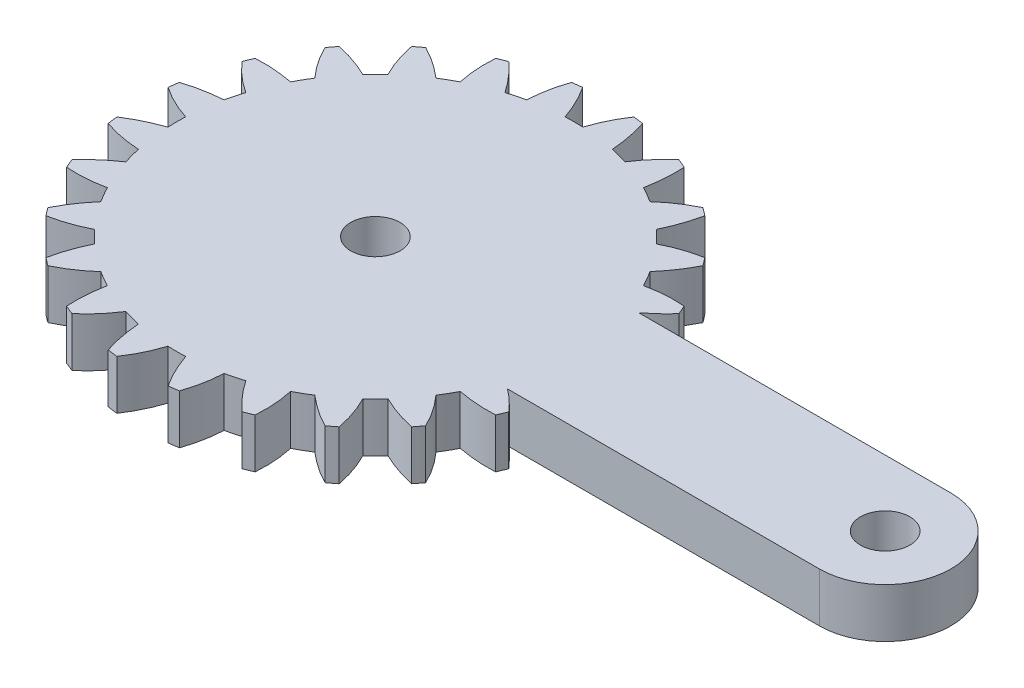
from build123d import *

# Parameters (mm, degrees)
SKETCH2_R           = 1.5
BOSS_EXTRUDE1_DEPTH = 3


with BuildPart() as part:
    # Sketch2 → Boss-Extrude1 (new body)
    with BuildSketch(Plane(origin=(0, 0, 0), x_dir=(1, 0, 0), z_dir=(0, 1, 0))):
        with BuildLine():
            Line((31, 4.000000001), (12.012859152, 4.000000001))
            add(Edge.make_bspline(
                [(13.278985865, 5.170206419), (12.8954662, 4.733530556), (12.462190225, 4.344528056), (12.012859152, 4.000000001)],
                knots=[0.154712813, 0.154712813, 0.154712813, 0.154712813, 0.777489596, 0.777489596, 0.777489596, 0.777489596], degree=3))
            ThreePointArc((13.278985865, 5.170206419), (13.165283338, 5.453238911), (13.045548971, 5.733772933))
            add(Edge.make_bspline(
                [(10.729735914, 5.571433139), (11.468148216, 5.731782959), (12.25282672, 5.797378255), (13.045548971, 5.733772933)],
                knots=[0, 0, 0, 0, 0.84522739, 0.84522739, 0.84522739, 0.84522739], degree=3))
            ThreePointArc((10.729735914, 5.571433139), (10.602635836, 5.809665509), (10.470247132, 6.045))
            ThreePointArc((10.470247132, 6.045), (10.332600838, 6.277376835), (10.189798038, 6.506620931))
            add(Edge.make_bspline(
                [(11.488367505, 8.430890348), (11.138958904, 7.723663869), (10.678280228, 7.077546079), (10.189798038, 6.506620931)],
                knots=[0.154712813, 0.154712813, 0.154712813, 0.154712813, 1, 1, 1, 1], degree=3))
            ThreePointArc((11.488367505, 8.430890348), (11.305285099, 8.674850363), (11.117023034, 8.914835886))
            add(Edge.make_bspline(
                [(8.922136024, 8.158651162), (9.593885949, 8.504652361), (10.334849869, 8.771102293), (11.117023034, 8.914835886)],
                knots=[0, 0, 0, 0, 0.84522739, 0.84522739, 0.84522739, 0.84522739], degree=3))
            ThreePointArc((8.922136024, 8.158651162), (8.737707702, 8.35587004), (8.548920985, 8.548920985))
            ThreePointArc((8.548920985, 8.548920985), (8.355821324, 8.737754288), (8.158551674, 8.922226997))
            add(Edge.make_bspline(
                [(8.914835886, 11.117023034), (8.760376776, 10.343461111), (8.482622935, 9.600126837), (8.158551674, 8.922226997)],
                knots=[0.154712813, 0.154712813, 0.154712813, 0.154712813, 1, 1, 1, 1], degree=3))
            ThreePointArc((8.914835886, 11.117023034), (8.674850363, 11.305285099), (8.430890348, 11.488367505))
            add(Edge.make_bspline(
                [(6.506507308, 10.189870591), (7.065816209, 10.697943759), (7.71257008, 11.147090204), (8.430890348, 11.488367505)],
                knots=[0, 0, 0, 0, 0.84522739, 0.84522739, 0.84522739, 0.84522739], degree=3))
            ThreePointArc((6.506507308, 10.189870591), (6.277319227, 10.332635836), (6.045, 10.470247132))
            ThreePointArc((6.045, 10.470247132), (5.809606396, 10.602668227), (5.571313495, 10.729798038))
            add(Edge.make_bspline(
                [(5.733772933, 13.045548971), (5.784789448, 12.258368573), (5.708888907, 11.468474815), (5.571313495, 10.729798038)],
                knots=[0.154712813, 0.154712813, 0.154712813, 0.154712813, 1, 1, 1, 1], degree=3))
            ThreePointArc((5.733772933, 13.045548971), (5.453238911, 13.165283338), (5.170206419, 13.278985865))
            add(Edge.make_bspline(
                [(3.647470872, 11.526667178), (4.056222772, 12.16218797), (4.564691385, 12.76342234), (5.170206419, 13.278985865)],
                knots=[0, 0, 0, 0, 0.84522739, 0.84522739, 0.84522739, 0.84522739], degree=3))
            ThreePointArc((3.647470872, 11.526667178), (3.389141821, 11.605249576), (3.129122255, 11.67804324))
            ThreePointArc((3.129122255, 11.67804324), (2.867476392, 11.745027848), (2.604399509, 11.806151075))
            add(Edge.make_bspline(
                [(2.161962831, 14.085042304), (2.414978279, 13.337888473), (2.546103534, 12.555265188), (2.604399509, 11.806151075)],
                knots=[0.154712813, 0.154712813, 0.154712813, 0.154712813, 1, 1, 1, 1], degree=3))
            ThreePointArc((2.161962831, 14.085042304), (1.859998239, 14.128089275), (1.557181466, 14.164663282))
            add(Edge.make_bspline(
                [(0.539865323, 12.077940447), (0.770204456, 12.797599169), (1.105736515, 13.509948335), (1.557181466, 14.164663282)],
                knots=[0, 0, 0, 0, 0.84522739, 0.84522739, 0.84522739, 0.84522739], degree=3))
            ThreePointArc((0.539865323, 12.077940447), (0.27, 12.086984736), (0, 12.09))
            ThreePointArc((0, 12.09), (-0.270067389, 12.08698323), (-0.54, 12.077934426))
            add(Edge.make_bspline(
                [(-1.557181466, 14.164663282), (-1.119409669, 13.508453317), (-0.790194587, 12.786434986), (-0.54, 12.077934426)],
                knots=[0.154712813, 0.154712813, 0.154712813, 0.154712813, 1, 1, 1, 1], degree=3))
            ThreePointArc((-1.557181466, 14.164663282), (-1.859998239, 14.128089275), (-2.161962831, 14.085042304))
            add(Edge.make_bspline(
                [(-2.604531155, 11.806122033), (-2.568302021, 12.560875133), (-2.42857247, 13.335793678), (-2.161962831, 14.085042304)],
                knots=[0, 0, 0, 0, 0.84522739, 0.84522739, 0.84522739, 0.84522739], degree=3))
            ThreePointArc((-2.604531155, 11.806122033), (-2.867541874, 11.74501186), (-3.129122255, 11.67804324))
            ThreePointArc((-3.129122255, 11.67804324), (-3.389206524, 11.60523068), (-3.647599401, 11.526626506))
            add(Edge.make_bspline(
                [(-5.170206419, 13.278985865), (-4.577511698, 12.75843939), (-4.072642252, 12.146230371), (-3.647599401, 11.526626506)],
                knots=[0.154712813, 0.154712813, 0.154712813, 0.154712813, 1, 1, 1, 1], degree=3))
            ThreePointArc((-5.170206419, 13.278985865), (-5.453238911, 13.165283338), (-5.733772933, 13.045548971))
            add(Edge.make_bspline(
                [(-5.571433139, 10.729735914), (-5.731782959, 11.468148216), (-5.797378255, 12.25282672), (-5.733772933, 13.045548971)],
                knots=[0, 0, 0, 0, 0.84522739, 0.84522739, 0.84522739, 0.84522739], degree=3))
            ThreePointArc((-5.571433139, 10.729735914), (-5.809665509, 10.602635836), (-6.045, 10.470247132))
            ThreePointArc((-6.045, 10.470247132), (-6.277376835, 10.332600838), (-6.506620931, 10.189798038))
            add(Edge.make_bspline(
                [(-8.430890348, 11.488367505), (-7.723663869, 11.138958904), (-7.077546079, 10.678280228), (-6.506620931, 10.189798038)],
                knots=[0.154712813, 0.154712813, 0.154712813, 0.154712813, 1, 1, 1, 1], degree=3))
            ThreePointArc((-8.430890348, 11.488367505), (-8.674850363, 11.305285099), (-8.914835886, 11.117023034))
            add(Edge.make_bspline(
                [(-8.158651162, 8.922136024), (-8.504652361, 9.593885949), (-8.771102293, 10.334849869), (-8.914835886, 11.117023034)],
                knots=[0, 0, 0, 0, 0.84522739, 0.84522739, 0.84522739, 0.84522739], degree=3))
            ThreePointArc((-8.158651162, 8.922136024), (-8.35587004, 8.737707702), (-8.548920985, 8.548920985))
            ThreePointArc((-8.548920985, 8.548920985), (-8.737754288, 8.355821324), (-8.922226997, 8.158551674))
            add(Edge.make_bspline(
                [(-11.117023034, 8.914835886), (-10.343461111, 8.760376776), (-9.600126837, 8.482622935), (-8.922226997, 8.158551674)],
                knots=[0.154712813, 0.154712813, 0.154712813, 0.154712813, 1, 1, 1, 1], degree=3))
            ThreePointArc((-11.117023034, 8.914835886), (-11.305285099, 8.674850363), (-11.488367505, 8.430890348))
            add(Edge.make_bspline(
                [(-10.189870591, 6.506507308), (-10.697943759, 7.065816209), (-11.147090204, 7.71257008), (-11.488367505, 8.430890348)],
                knots=[0, 0, 0, 0, 0.84522739, 0.84522739, 0.84522739, 0.84522739], degree=3))
            ThreePointArc((-10.189870591, 6.506507308), (-10.332635836, 6.277319227), (-10.470247132, 6.045))
            ThreePointArc((-10.470247132, 6.045), (-10.602668227, 5.809606396), (-10.729798038, 5.571313495))
            add(Edge.make_bspline(
                [(-13.045548971, 5.733772933), (-12.258368573, 5.784789448), (-11.468474815, 5.708888907), (-10.729798038, 5.571313495)],
                knots=[0.154712813, 0.154712813, 0.154712813, 0.154712813, 1, 1, 1, 1], degree=3))
            ThreePointArc((-13.045548971, 5.733772933), (-13.165283338, 5.453238911), (-13.278985865, 5.170206419))
            add(Edge.make_bspline(
                [(-11.526667178, 3.647470872), (-12.16218797, 4.056222772), (-12.76342234, 4.564691385), (-13.278985865, 5.170206419)],
                knots=[0, 0, 0, 0, 0.84522739, 0.84522739, 0.84522739, 0.84522739], degree=3))
            ThreePointArc((-11.526667178, 3.647470872), (-11.605249576, 3.389141821), (-11.67804324, 3.129122255))
            ThreePointArc((-11.67804324, 3.129122255), (-11.745027848, 2.867476392), (-11.806151075, 2.604399509))
            add(Edge.make_bspline(
                [(-14.085042304, 2.161962831), (-13.337888473, 2.414978279), (-12.555265188, 2.546103534), (-11.806151075, 2.604399509)],
                knots=[0.154712813, 0.154712813, 0.154712813, 0.154712813, 1, 1, 1, 1], degree=3))
            ThreePointArc((-14.085042304, 2.161962831), (-14.128089275, 1.859998239), (-14.164663282, 1.557181466))
            add(Edge.make_bspline(
                [(-12.077940447, 0.539865323), (-12.797599169, 0.770204456), (-13.509948335, 1.105736515), (-14.164663282, 1.557181466)],
                knots=[0, 0, 0, 0, 0.84522739, 0.84522739, 0.84522739, 0.84522739], degree=3))
            ThreePointArc((-12.077940447, 0.539865323), (-12.086984736, 0.27), (-12.09, 0))
            ThreePointArc((-12.09, 0), (-12.08698323, -0.270067389), (-12.077934426, -0.54))
            add(Edge.make_bspline(
                [(-14.164663282, -1.557181466), (-13.508453317, -1.119409669), (-12.786434986, -0.790194587), (-12.077934426, -0.54)],
                knots=[0.154712813, 0.154712813, 0.154712813, 0.154712813, 1, 1, 1, 1], degree=3))
            ThreePointArc((-14.164663282, -1.557181466), (-14.128089275, -1.859998239), (-14.085042304, -2.161962831))
            add(Edge.make_bspline(
                [(-11.806122033, -2.604531155), (-12.560875133, -2.568302021), (-13.335793678, -2.42857247), (-14.085042304, -2.161962831)],
                knots=[0, 0, 0, 0, 0.84522739, 0.84522739, 0.84522739, 0.84522739], degree=3))
            ThreePointArc((-11.806122033, -2.604531155), (-11.74501186, -2.867541874), (-11.67804324, -3.129122255))
            ThreePointArc((-11.67804324, -3.129122255), (-11.60523068, -3.389206524), (-11.526626506, -3.647599401))
            add(Edge.make_bspline(
                [(-13.278985865, -5.170206419), (-12.75843939, -4.577511698), (-12.146230371, -4.072642252), (-11.526626506, -3.647599401)],
                knots=[0.154712813, 0.154712813, 0.154712813, 0.154712813, 1, 1, 1, 1], degree=3))
            ThreePointArc((-13.278985865, -5.170206419), (-13.165283338, -5.453238911), (-13.045548971, -5.733772933))
            add(Edge.make_bspline(
                [(-10.729735914, -5.571433139), (-11.468148216, -5.731782959), (-12.25282672, -5.797378255), (-13.045548971, -5.733772933)],
                knots=[0, 0, 0, 0, 0.84522739, 0.84522739, 0.84522739, 0.84522739], degree=3))
            ThreePointArc((-10.729735914, -5.571433139), (-10.602635836, -5.809665509), (-10.470247132, -6.045))
            ThreePointArc((-10.470247132, -6.045), (-10.332600838, -6.277376835), (-10.189798038, -6.506620931))
            add(Edge.make_bspline(
                [(-11.488367505, -8.430890348), (-11.138958904, -7.723663869), (-10.678280228, -7.077546079), (-10.189798038, -6.506620931)],
                knots=[0.154712813, 0.154712813, 0.154712813, 0.154712813, 1, 1, 1, 1], degree=3))
            ThreePointArc((-11.488367505, -8.430890348), (-11.305285099, -8.674850363), (-11.117023034, -8.914835886))
            add(Edge.make_bspline(
                [(-8.922136024, -8.158651162), (-9.593885949, -8.504652361), (-10.334849869, -8.771102293), (-11.117023034, -8.914835886)],
                knots=[0, 0, 0, 0, 0.84522739, 0.84522739, 0.84522739, 0.84522739], degree=3))
            ThreePointArc((-8.922136024, -8.158651162), (-8.737707702, -8.35587004), (-8.548920985, -8.548920985))
            ThreePointArc((-8.548920985, -8.548920985), (-8.355821324, -8.737754288), (-8.158551674, -8.922226997))
            add(Edge.make_bspline(
                [(-8.914835886, -11.117023034), (-8.760376776, -10.343461111), (-8.482622935, -9.600126837), (-8.158551674, -8.922226997)],
                knots=[0.154712813, 0.154712813, 0.154712813, 0.154712813, 1, 1, 1, 1], degree=3))
            ThreePointArc((-8.914835886, -11.117023034), (-8.674850363, -11.305285099), (-8.430890348, -11.488367505))
            add(Edge.make_bspline(
                [(-6.506507308, -10.189870591), (-7.065816209, -10.697943759), (-7.71257008, -11.147090204), (-8.430890348, -11.488367505)],
                knots=[0, 0, 0, 0, 0.84522739, 0.84522739, 0.84522739, 0.84522739], degree=3))
            ThreePointArc((-6.506507308, -10.189870591), (-6.277319227, -10.332635836), (-6.045, -10.470247132))
            ThreePointArc((-6.045, -10.470247132), (-5.809606396, -10.602668227), (-5.571313495, -10.729798038))
            add(Edge.make_bspline(
                [(-5.733772933, -13.045548971), (-5.784789448, -12.258368573), (-5.708888907, -11.468474815), (-5.571313495, -10.729798038)],
                knots=[0.154712813, 0.154712813, 0.154712813, 0.154712813, 1, 1, 1, 1], degree=3))
            ThreePointArc((-5.733772933, -13.045548971), (-5.453238911, -13.165283338), (-5.170206419, -13.278985865))
            add(Edge.make_bspline(
                [(-3.647470872, -11.526667178), (-4.056222772, -12.16218797), (-4.564691385, -12.76342234), (-5.170206419, -13.278985865)],
                knots=[0, 0, 0, 0, 0.84522739, 0.84522739, 0.84522739, 0.84522739], degree=3))
            ThreePointArc((-3.647470872, -11.526667178), (-3.389141821, -11.605249576), (-3.129122255, -11.67804324))
            ThreePointArc((-3.129122255, -11.67804324), (-2.867476392, -11.745027848), (-2.604399509, -11.806151075))
            add(Edge.make_bspline(
                [(-2.161962831, -14.085042304), (-2.414978279, -13.337888473), (-2.546103534, -12.555265188), (-2.604399509, -11.806151075)],
                knots=[0.154712813, 0.154712813, 0.154712813, 0.154712813, 1, 1, 1, 1], degree=3))
            ThreePointArc((-2.161962831, -14.085042304), (-1.859998239, -14.128089275), (-1.557181466, -14.164663282))
            add(Edge.make_bspline(
                [(-0.539865323, -12.077940447), (-0.770204456, -12.797599169), (-1.105736515, -13.509948335), (-1.557181466, -14.164663282)],
                knots=[0, 0, 0, 0, 0.84522739, 0.84522739, 0.84522739, 0.84522739], degree=3))
            ThreePointArc((-0.539865323, -12.077940447), (-0.27, -12.086984736), (0, -12.09))
            ThreePointArc((0, -12.09), (0.270067389, -12.08698323), (0.54, -12.077934426))
            add(Edge.make_bspline(
                [(1.557181466, -14.164663282), (1.119409669, -13.508453317), (0.790194587, -12.786434986), (0.54, -12.077934426)],
                knots=[0.154712813, 0.154712813, 0.154712813, 0.154712813, 1, 1, 1, 1], degree=3))
            ThreePointArc((1.557181466, -14.164663282), (1.859998239, -14.128089275), (2.161962831, -14.085042304))
            add(Edge.make_bspline(
                [(2.604531155, -11.806122033), (2.568302021, -12.560875133), (2.42857247, -13.335793678), (2.161962831, -14.085042304)],
                knots=[0, 0, 0, 0, 0.84522739, 0.84522739, 0.84522739, 0.84522739], degree=3))
            ThreePointArc((2.604531155, -11.806122033), (2.867541874, -11.74501186), (3.129122255, -11.67804324))
            ThreePointArc((3.129122255, -11.67804324), (3.389206524, -11.60523068), (3.647599401, -11.526626506))
            add(Edge.make_bspline(
                [(5.170206419, -13.278985865), (4.577511698, -12.75843939), (4.072642252, -12.146230371), (3.647599401, -11.526626506)],
                knots=[0.154712813, 0.154712813, 0.154712813, 0.154712813, 1, 1, 1, 1], degree=3))
            ThreePointArc((5.170206419, -13.278985865), (5.453238911, -13.165283338), (5.733772933, -13.045548971))
            add(Edge.make_bspline(
                [(5.571433139, -10.729735914), (5.731782959, -11.468148216), (5.797378255, -12.25282672), (5.733772933, -13.045548971)],
                knots=[0, 0, 0, 0, 0.84522739, 0.84522739, 0.84522739, 0.84522739], degree=3))
            ThreePointArc((5.571433139, -10.729735914), (5.809665509, -10.602635836), (6.045, -10.470247132))
            ThreePointArc((6.045, -10.470247132), (6.277376835, -10.332600838), (6.506620931, -10.189798038))
            add(Edge.make_bspline(
                [(8.430890348, -11.488367505), (7.723663869, -11.138958904), (7.077546079, -10.678280228), (6.506620931, -10.189798038)],
                knots=[0.154712813, 0.154712813, 0.154712813, 0.154712813, 1, 1, 1, 1], degree=3))
            ThreePointArc((8.430890348, -11.488367505), (8.674850363, -11.305285099), (8.914835886, -11.117023034))
            add(Edge.make_bspline(
                [(8.158651162, -8.922136024), (8.504652361, -9.593885949), (8.771102293, -10.334849869), (8.914835886, -11.117023034)],
                knots=[0, 0, 0, 0, 0.84522739, 0.84522739, 0.84522739, 0.84522739], degree=3))
            ThreePointArc((8.158651162, -8.922136024), (8.35587004, -8.737707702), (8.548920985, -8.548920985))
            ThreePointArc((8.548920985, -8.548920985), (8.737754288, -8.355821324), (8.922226997, -8.158551674))
            add(Edge.make_bspline(
                [(11.117023034, -8.914835886), (10.343461111, -8.760376776), (9.600126837, -8.482622935), (8.922226997, -8.158551674)],
                knots=[0.154712813, 0.154712813, 0.154712813, 0.154712813, 1, 1, 1, 1], degree=3))
            ThreePointArc((11.117023034, -8.914835886), (11.305285099, -8.674850363), (11.488367505, -8.430890348))
            add(Edge.make_bspline(
                [(10.189870591, -6.506507308), (10.697943759, -7.065816209), (11.147090204, -7.71257008), (11.488367505, -8.430890348)],
                knots=[0, 0, 0, 0, 0.84522739, 0.84522739, 0.84522739, 0.84522739], degree=3))
            ThreePointArc((10.189870591, -6.506507308), (10.332635836, -6.277319227), (10.470247132, -6.045))
            ThreePointArc((10.470247132, -6.045), (10.602668227, -5.809606396), (10.729798038, -5.571313495))
            add(Edge.make_bspline(
                [(13.045548971, -5.733772933), (12.258368573, -5.784789448), (11.468474815, -5.708888907), (10.729798038, -5.571313495)],
                knots=[0.154712813, 0.154712813, 0.154712813, 0.154712813, 1, 1, 1, 1], degree=3))
            ThreePointArc((13.045548971, -5.733772933), (13.165283338, -5.453238911), (13.278985865, -5.170206419))
            add(Edge.make_bspline(
                [(12.032510858, -3.999999999), (12.480346232, -4.337627374), (12.902507267, -4.728042767), (13.278985865, -5.170206419)],
                knots=[0.228019214, 0.228019214, 0.228019214, 0.228019214, 0.84522739, 0.84522739, 0.84522739, 0.84522739], degree=3))
            Line((12.032510858, -3.999999999), (31, -3.999999999))
            ThreePointArc((31, -3.999999999), (35, 1e-09), (31, 4.000000001))
        make_face()
        with Locations(Location((31, 1e-09, 0), (0, 0, 270))):
            Circle(SKETCH2_R, mode=Mode.SUBTRACT)
        with Locations(Location((0, 0, 0), (0, 0, 270))):
            Circle(SKETCH2_R, mode=Mode.SUBTRACT)
    extrude(amount=BOSS_EXTRUDE1_DEPTH)


solid = part.part
